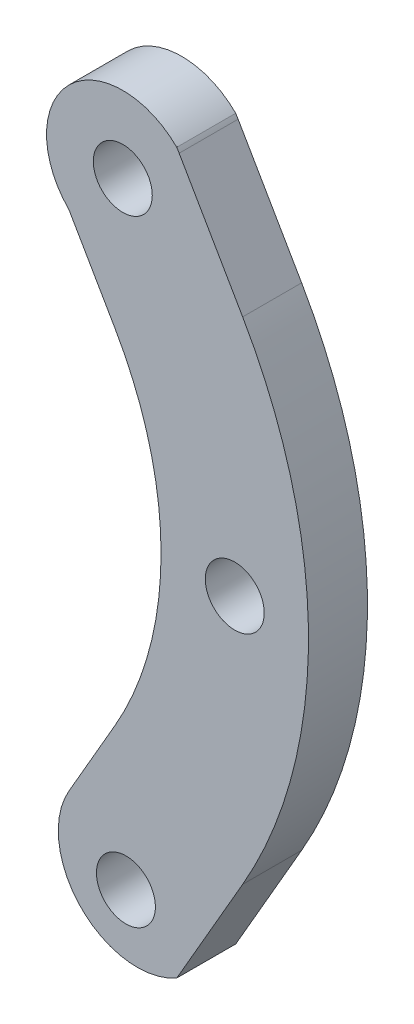
from build123d import *

# Parameters (mm, degrees)
SKETCH1_R           = 3
BOSS_EXTRUDE1_DEPTH = 6


with BuildPart() as part:
    # Sketch1 → Boss-Extrude1 (new body)
    with BuildSketch(Plane.XY):
        with BuildLine():
            Line((29.097558797, 17.5), (24.40844793, 25.621778265))
            ThreePointArc((24.40844793, 25.621778265), (24.40844793, 36.592231664), (35.378901329, 36.592231664))
            ThreePointArc((35.378901329, 36.592231664), (35.506003821, 36.393205072), (35.627115001, 36.190476904))
            Line((35.627115001, 36.190476904), (42.087939854, 25))
            ThreePointArc((42.087939854, 25), (48.786669665, 0), (42.087939854, -25))
            Line((42.087939854, -25), (35.389210043, -36.602540378))
            ThreePointArc((35.389210043, -36.602540378), (25.685911427, -35.325076881), (24.40844793, -25.621778265))
            Line((24.40844793, -25.621778265), (29.097558797, -17.5))
            ThreePointArc((29.097558797, -17.5), (33.786669665, 0), (29.097558797, 17.5))
        make_face()
        with Locations((41.286669665, 0)):
            Circle(SKETCH1_R, mode=Mode.SUBTRACT)
        with Locations((30.212002479, -31.425332814)):
            Circle(SKETCH1_R, mode=Mode.SUBTRACT)
        with Locations((29.893674629, 31.107004965)):
            Circle(SKETCH1_R, mode=Mode.SUBTRACT)
    extrude(amount=BOSS_EXTRUDE1_DEPTH)


solid = part.part
